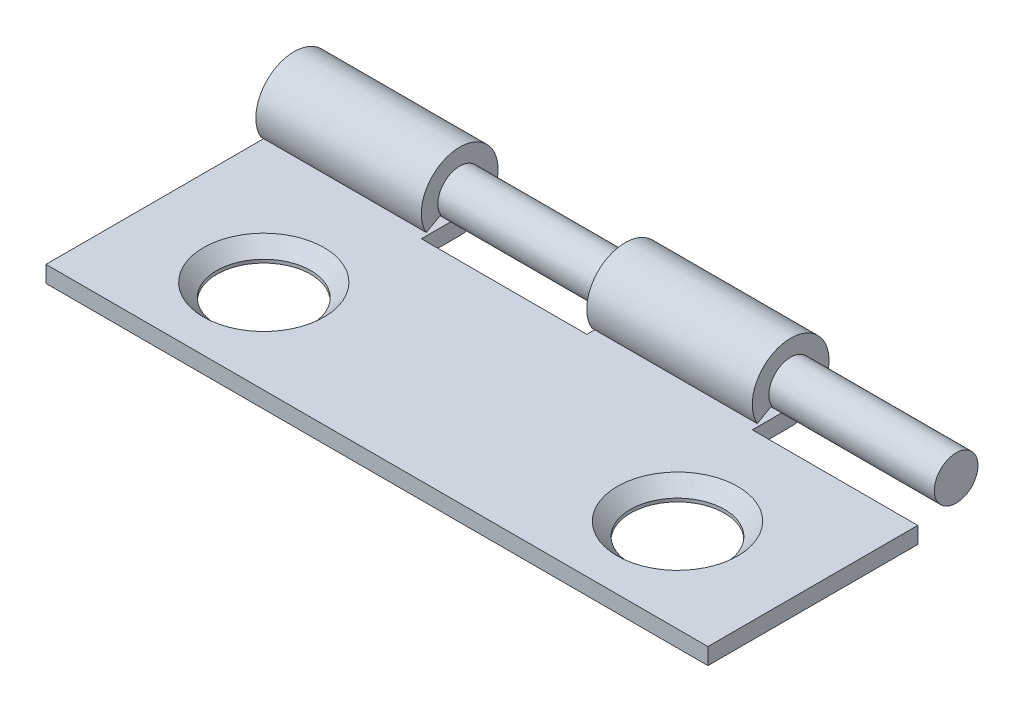
from build123d import *

# Parameters (mm, degrees)
BOSS_EXTRUDE1_DEPTH     = 12.7
SKETCH4_W               = 6.35
SKETCH4_H               = 2.9464
CUT_EXTRUDE1_DEPTH      = 16.943209942
LPATTERN1_COUNT         = 6
LPATTERN1_PITCH         = 12.7
CUT_EXTRUDE3_DEPTH      = 16.943209942
CUT_EXTRUDE3_DEPTH_BACK = 16.943209942
SKETCH9_R               = 1.8034
SKETCH6_R               = 0.8382
BOSS_EXTRUDE2_DEPTH     = 12.7


with BuildPart() as part:
    # Sketch3 → Boss-Extrude1 (new, symmetric)
    with BuildSketch(Plane(origin=(0, 0, 0), x_dir=(0, 0, -1), z_dir=(1, 0, 0))):
        with BuildLine():
            Line((0, -1.4732), (-9.525, -1.4732))
            Line((-9.525, -1.4732), (-9.525, -0.8382))
            Line((-9.525, -0.8382), (0, -0.8382))
            ThreePointArc((0, -0.8382), (0.421388638, 0.724576328), (-0.728533124, -0.414510226))
            Line((-0.728533124, -0.414510226), (-1.280452157, -0.728533124))
            ThreePointArc((-1.280452157, -0.728533124), (0.740622455, 1.273497789), (0, -1.4732))
        make_face()
    extrude(amount=BOSS_EXTRUDE1_DEPTH, both=True)

    # Sketch4 → Cut-Extrude1 (cut, symmetric)
    with BuildSketch(Plane(origin=(0, 0, 0), x_dir=(1, 0, 0), z_dir=(0, 1, 0))):
        with Locations((-3.175, 0)):
            Rectangle(SKETCH4_W, SKETCH4_H)
    cut_extrude1 = extrude(amount=CUT_EXTRUDE1_DEPTH, both=True, mode=Mode.SUBTRACT)

    # LPattern1: Cut-Extrude1 ×6
    with Locations(*[(i * LPATTERN1_PITCH, 0, 0) for i in range(1, LPATTERN1_COUNT)]):
        add(cut_extrude1, mode=Mode.SUBTRACT)

    # Cut-Extrude2 cone 1 section (through the dimple's axis) → Cut-Extrude2 (revolve, cut)
    with BuildSketch(Plane(origin=(7.9502, -0.8382, 5.9436), x_dir=(0, 0, 1), z_dir=(1, 0, 0))):
        Polygon((0, 0), (2.3114, 0), (0, 2.3114), align=None)
    revolve(axis=Axis((7.9502, -0.8382, 5.9436), (0, -1, 0)), mode=Mode.SUBTRACT)

    # Cut-Extrude2 cone 2 section (through the dimple's axis) → Cut-Extrude2 cone 2 (revolve, cut)
    with BuildSketch(Plane(origin=(-7.9248, -0.8382, 5.9436), x_dir=(0, 0, 1), z_dir=(1, 0, 0))):
        Polygon((0, 0), (2.3114, 0), (0, 2.3114), align=None)
    revolve(axis=Axis((-7.9248, -0.8382, 5.9436), (0, -1, 0)), mode=Mode.SUBTRACT)

    # Sketch9 → Cut-Extrude3 (cut, two sides: drawn at the far end of the back side and taken through both)
    with BuildSketch(Plane(origin=(0, 0, 0), x_dir=(1, 0, 0), z_dir=(0, 1, 0)).offset(-CUT_EXTRUDE3_DEPTH_BACK)):
        with Locations(Location((7.9502, -5.9436, 0), (0, 0, 270))):
            Circle(SKETCH9_R)
        with Locations(Location((-7.9248, -5.9436, 0), (0, 0, 270))):
            Circle(SKETCH9_R)
    extrude(amount=CUT_EXTRUDE3_DEPTH + CUT_EXTRUDE3_DEPTH_BACK, mode=Mode.SUBTRACT)


with BuildPart() as body_2:
    # Sketch6 → Boss-Extrude2 (new, symmetric)
    with BuildSketch(Plane(origin=(0, 0, 0), x_dir=(0, 0, -1), z_dir=(1, 0, 0))):
        Circle(SKETCH6_R)
    extrude(amount=BOSS_EXTRUDE2_DEPTH, both=True)


solid = Compound([part.part, body_2.part])
